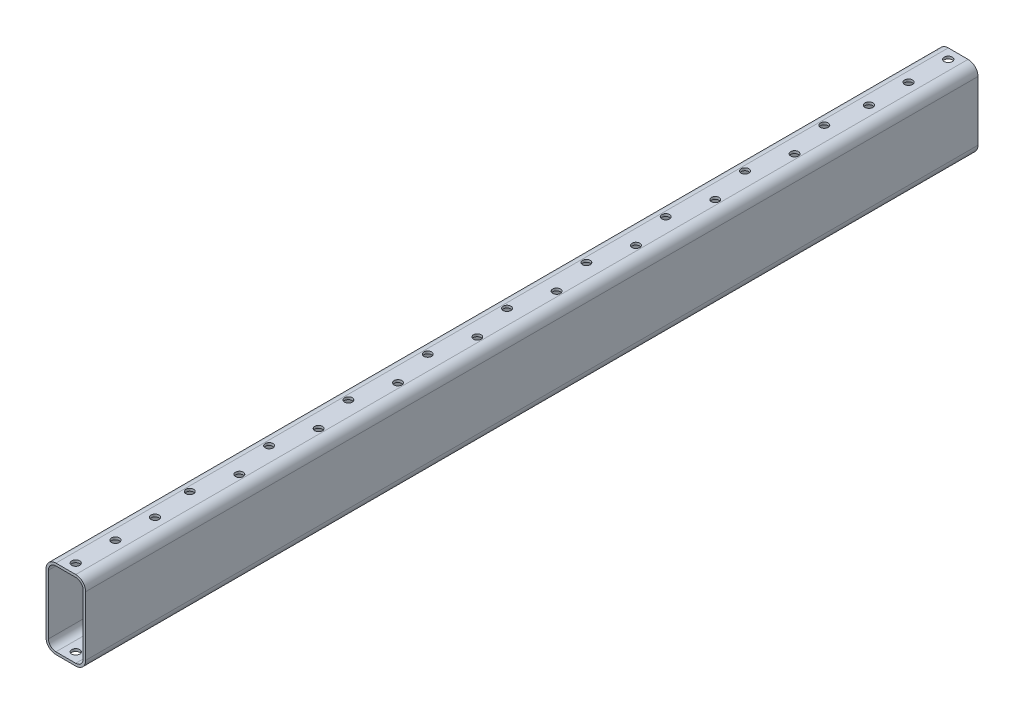
from build123d import *

# Parameters (mm, degrees)
EXTRUDE_THIN1_DEPTH               = 571.5
F_10_CLEARANCE_HOLE1_D            = 5.1054
F_3_16_0_195_DIAMETER_HOLE1_D     = 4.953
F_3_16_0_195_DIAMETER_HOLE1_DEPTH = 1.5875


with BuildPart() as part:
    # Sketch1 → Extrude-Thin1 (new body)
    with BuildSketch(Plane.XY):
        with BuildLine():
            Line((-12.7, 19.05), (-12.7, -19.05))
            ThreePointArc((-12.7, -19.05), (-10.840128061, -23.540128061), (-6.35, -25.4))
            Line((-6.35, -25.4), (6.35, -25.4))
            ThreePointArc((6.35, -25.4), (10.840128061, -23.540128061), (12.7, -19.05))
            Line((12.7, -19.05), (12.7, 19.05))
            ThreePointArc((12.7, 19.05), (10.840128061, 23.540128061), (6.35, 25.4))
            Line((6.35, 25.4), (-6.35, 25.4))
            ThreePointArc((-6.35, 25.4), (-10.840128061, 23.540128061), (-12.7, 19.05))
        make_face()
        with BuildLine():
            Line((-11.1125, 19.05), (-11.1125, -19.05))
            ThreePointArc((-11.1125, -19.05), (-9.717596045, -22.417596045), (-6.35, -23.8125))
            Line((-6.35, -23.8125), (6.35, -23.8125))
            ThreePointArc((6.35, -23.8125), (9.717596045, -22.417596045), (11.1125, -19.05))
            Line((11.1125, -19.05), (11.1125, 19.05))
            ThreePointArc((11.1125, 19.05), (9.717596045, 22.417596045), (6.35, 23.8125))
            Line((6.35, 23.8125), (-6.35, 23.8125))
            ThreePointArc((-6.35, 23.8125), (-9.717596045, 22.417596045), (-11.1125, 19.05))
        make_face(mode=Mode.SUBTRACT)
    extrude(amount=EXTRUDE_THIN1_DEPTH)

    # #10 Clearance Hole1 (through all)
    with Locations(Plane(origin=(0, 25.4, 565.15), x_dir=(0, 0, 1), z_dir=(0, 1, 0))):
        with Locations((0, 0), (-558.8, 0), (-533.4, 0), (-508, 0), (-25.4, 0), (-50.8, 0)):
            Hole(F_10_CLEARANCE_HOLE1_D / 2)

    # 3/16 (0.195) Diameter Hole1
    with Locations(Plane(origin=(0, 25.4, 0), x_dir=(1, 0, 0), z_dir=(0, 1, 0))):
        with Locations((-3.175, -82.55), (3.175, -107.95), (-3.175, -133.35), (3.175, -158.75), (-3.175, -184.15), (3.175, -209.55), (-3.175, -234.95), (3.175, -260.35), (-3.175, -285.75), (3.175, -311.15), (-3.175, -336.55), (3.175, -361.95), (-3.175, -387.35), (3.175, -412.75), (-3.175, -438.15), (3.175, -463.55), (-3.175, -488.95)):
            Hole(F_3_16_0_195_DIAMETER_HOLE1_D / 2, depth=F_3_16_0_195_DIAMETER_HOLE1_DEPTH)


solid = part.part
